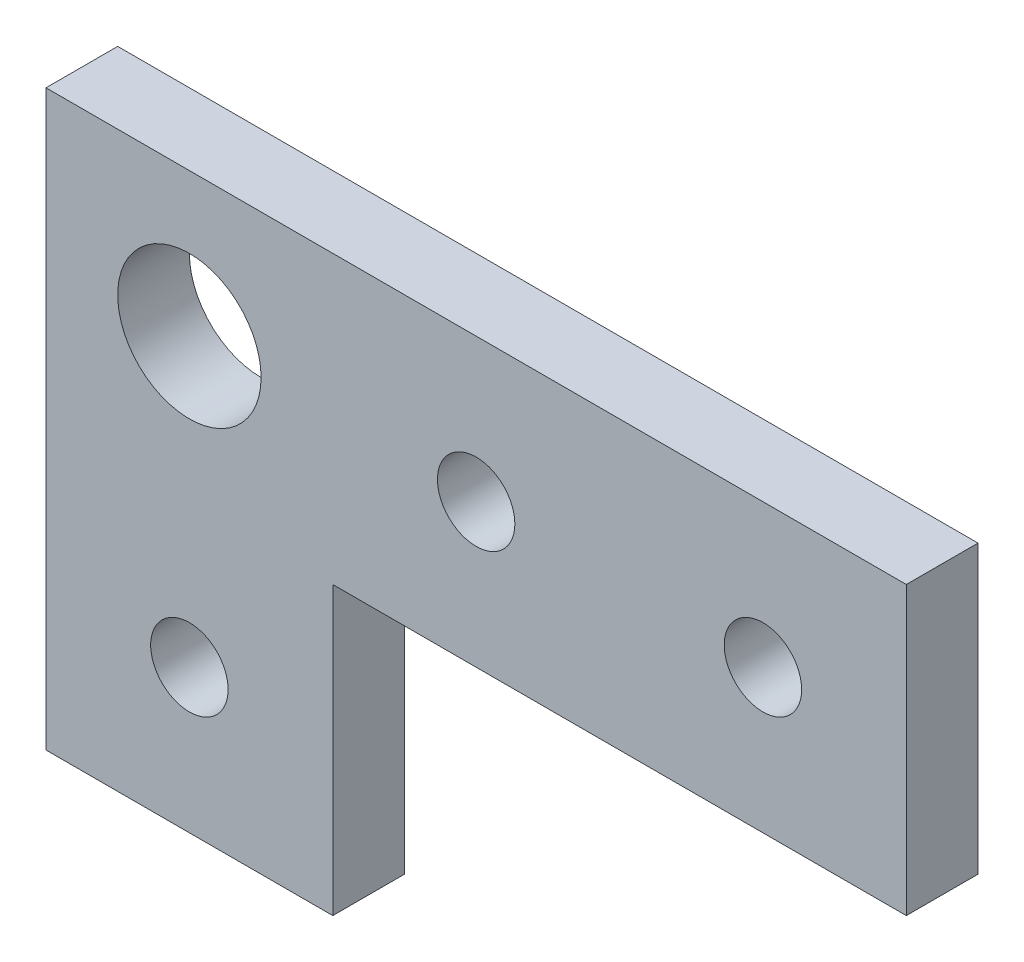
from build123d import *

# Parameters (mm, degrees)
BOSS_EXTRUDE1_DEPTH = 6.35
SKETCH2_R           = 6.35
SKETCH2_R_2         = 3.429
CUT_EXTRUDE1_DEPTH  = 6.35


with BuildPart() as part:
    # Sketch1 → Boss-Extrude1 (new body)
    with BuildSketch(Plane.XY):
        Polygon((0, 0), (0, 50.8), (76.2, 50.8), (76.2, 25.4), (25.4, 25.4), (25.4, 0), align=None)
    extrude(amount=BOSS_EXTRUDE1_DEPTH)

    # Sketch2 → Cut-Extrude1 (cut)
    with BuildSketch(Plane.XY.offset(6.35)):
        with Locations((12.7, 38.1)):
            Circle(SKETCH2_R)
        with Locations((12.7, 12.7)):
            Circle(SKETCH2_R_2)
        with Locations((38.1, 38.1)):
            Circle(SKETCH2_R_2)
        with Locations((63.5, 38.1)):
            Circle(SKETCH2_R_2)
    extrude(amount=-CUT_EXTRUDE1_DEPTH, mode=Mode.SUBTRACT)


solid = part.part
